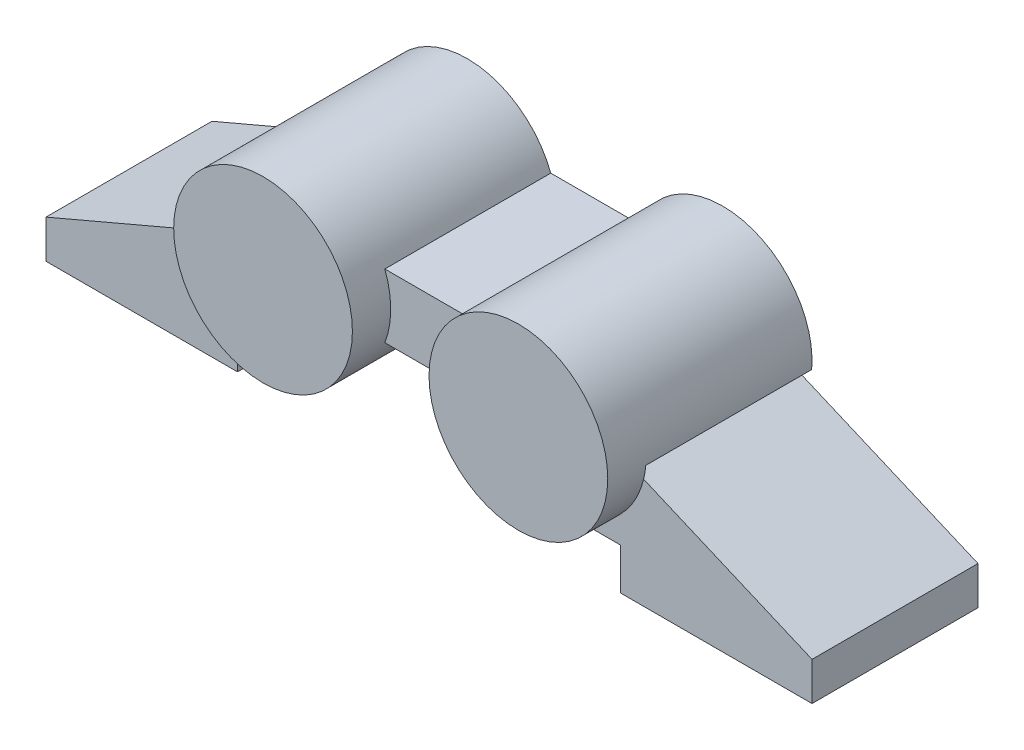
from build123d import *
from build123d.topology import SkipClean

# Parameters (mm, degrees)
SKETCH1_R           = 7
BOSS_EXTRUDE1_DEPTH = 13
SKETCH2_R           = 7
BOSS_EXTRUDE2_DEPTH = 3
SKETCH3_R           = 3
CUT_EXTRUDE1_DEPTH  = 13


with BuildPart() as part:
    # Sketch1 → Boss-Extrude1 (new body)
    with BuildSketch(Plane.XY):
        with BuildLine():
            ThreePointArc((16.808917195, -9.124391157), (14.337583538, -12.994121317), (10, -14.5))
            Line((10, -14.5), (15, -14.5))
            Line((15, -14.5), (15, -17.75))
            Line((15, -17.75), (30, -17.75))
            Line((30, -17.75), (30, -14.75))
            Line((30, -14.75), (16.808917195, -9.124391157))
        make_face()
        with Locations((10, -7.5)):
            Circle(SKETCH1_R)
        with BuildLine():
            Line((0, -10), (3.461651585, -10))
            ThreePointArc((3.461651585, -10), (3, -7.5), (3.461651585, -5))
            Line((3.461651585, -5), (0, -5))
            Line((0, -5), (0, -10))
        make_face()
    extrude(amount=BOSS_EXTRUDE1_DEPTH)

    # Sketch2 → Boss-Extrude2 (add)
    with BuildSketch(Plane.XY.offset(13)):
        with Locations(Location((10, -7.5, 0), (0, 0, 200.924832428))):
            Circle(SKETCH2_R)
    extrude(amount=BOSS_EXTRUDE2_DEPTH)

    # Sketch3 → Cut-Extrude1 (cut)
    with BuildSketch(Plane.XY):
        with Locations((10, -7.5)):
            Circle(SKETCH3_R)
        with BuildLine():
            Line((16.808917195, -9.124391157), (17.20120329, -8.204547899))
            Line((17.20120329, -8.204547899), (12.752773317, -6.307423351))
            ThreePointArc((12.752773317, -6.307423351), (12.937543187, -6.891033643), (13, -7.5))
            Line((13, -7.5), (16.808917195, -9.124391157))
        make_face()
    extrude(amount=CUT_EXTRUDE1_DEPTH, mode=Mode.SUBTRACT)

    # Mirror1: part across plane


with BuildPart() as part_1:
    with SkipClean():  # the faces are left unmerged after this step: merging them gives an invalid solid
        add(part.part)
        add(part.part.mirror(Plane(origin=(0, 0, 0), x_dir=(0, 0, 1), z_dir=(1, 0, 0))))


solid = part_1.part
